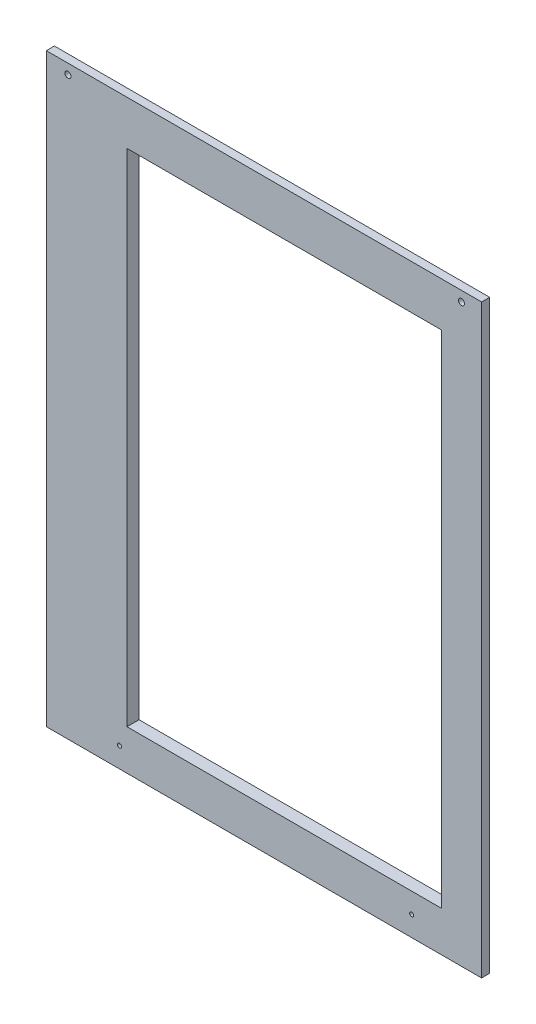
from build123d import *

# Parameters (mm, degrees)
ESQUISSE1_W             = 206
ESQUISSE1_H             = 278.55339059
BOSS_EXTRU_1_DEPTH      = 4
ESQUISSE2_W             = 216
ESQUISSE2_H             = 290.55339059
BOSS_EXTRU_2_DEPTH      = 4
ESQUISSE3_W             = 156
ESQUISSE3_H             = 248.55339059
ENL_V_MAT_EXTRU_1_DEPTH = 8
ENL_V_MAT_EXTRU_2_DEPTH = 2
ESQUISSE5_R             = 1.5
ENL_V_MAT_EXTRU_3_DEPTH = 4
ESQUISSE6_R             = 3
ENL_V_MAT_EXTRU_4_DEPTH = 4
ESQUISSE7_R             = 1
ENL_V_MAT_EXTRU_5_DEPTH = 739.46020643


with BuildPart() as part:
    # Esquisse1 → Boss.-Extru.1 (new body)
    with BuildSketch(Plane.XY):
        with Locations((121.349909903, 555.619376292)):
            Rectangle(ESQUISSE1_W, ESQUISSE1_H)
    extrude(amount=BOSS_EXTRU_1_DEPTH)

    # Esquisse2 → Boss.-Extru.2 (add)
    with BuildSketch(Plane.XY.offset(4)):
        with Locations((121.349909903, 556.619376292)):
            Rectangle(ESQUISSE2_W, ESQUISSE2_H)
    extrude(amount=BOSS_EXTRU_2_DEPTH)

    # Esquisse3 → Enlèv. mat.-Extru.1 (cut)
    with BuildSketch(Plane(origin=(0, 0, 0), x_dir=(-1, 0, 0), z_dir=(0, 0, -1))):
        with Locations((-131.349909903, 555.619376292)):
            Rectangle(ESQUISSE3_W, ESQUISSE3_H)
    extrude(amount=-ENL_V_MAT_EXTRU_1_DEPTH, mode=Mode.SUBTRACT)

    # Esquisse4 → Enlèv. mat.-Extru.2 (cut)
    with BuildSketch(Plane(origin=(0, 0, 0), x_dir=(-1, 0, 0), z_dir=(0, 0, -1))):
        with BuildLine():
            Line((-212.228589559, 684.896071587), (-50.471230246, 684.896071587))
            ThreePointArc((-50.471230246, 684.896071587), (-48.349909903, 684.896071587), (-48.349909903, 682.774751243))
            Line((-48.349909903, 682.774751243), (-48.349909903, 428.418245014))
            ThreePointArc((-48.349909903, 428.418245014), (-48.51477084, 426.464915653), (-50.471230246, 426.342680997))
            Line((-50.471230246, 426.342680997), (-51.11665592, 426.342680997))
            Line((-51.11665592, 426.342680997), (-211.583163885, 426.342680997))
            Line((-211.583163885, 426.342680997), (-212.228589559, 426.342680997))
            ThreePointArc((-212.228589559, 426.342680997), (-214.185048965, 426.464915653), (-214.349909903, 428.418245014))
            Line((-214.349909903, 428.418245014), (-214.349909903, 682.774751243))
            ThreePointArc((-214.349909903, 682.774751243), (-214.349909903, 684.896071587), (-212.228589559, 684.896071587))
        make_face()
    extrude(amount=-ENL_V_MAT_EXTRU_2_DEPTH, mode=Mode.SUBTRACT)

    # Esquisse5 → Enlèv. mat.-Extru.3 (cut)
    with BuildSketch(Plane(origin=(0, 0, 4), x_dir=(-1, 0, 0), z_dir=(0, 0, -1))):
        with Locations((-219.349909903, 696.896071587)):
            Circle(ESQUISSE5_R)
        with Locations(Location((-24.067400597, 696.896071587, 0), (0, 0, 180))):
            Circle(ESQUISSE5_R)
    extrude(amount=-ENL_V_MAT_EXTRU_3_DEPTH, mode=Mode.SUBTRACT)

    # Esquisse6 → Enlèv. mat.-Extru.4 (cut)
    with BuildSketch(Plane(origin=(0, 0, 0), x_dir=(-1, 0, 0), z_dir=(0, 0, -1))):
        with Locations((-24.067400597, 696.896071587)):
            Circle(ESQUISSE6_R)
        with Locations((-219.349909903, 696.896071587)):
            Circle(ESQUISSE6_R)
    extrude(amount=-ENL_V_MAT_EXTRU_4_DEPTH, mode=Mode.SUBTRACT)

    # Esquisse7 → Enlèv. mat.-Extru.5 (cut, through all)
    with BuildSketch(Plane.XY.offset(8)):
        with Locations((49.662982919, 421.342680997)):
            Circle(ESQUISSE7_R)
        with Locations((194.662982919, 421.342680997)):
            Circle(ESQUISSE7_R)
    extrude(amount=-ENL_V_MAT_EXTRU_5_DEPTH, mode=Mode.SUBTRACT)


solid = part.part
